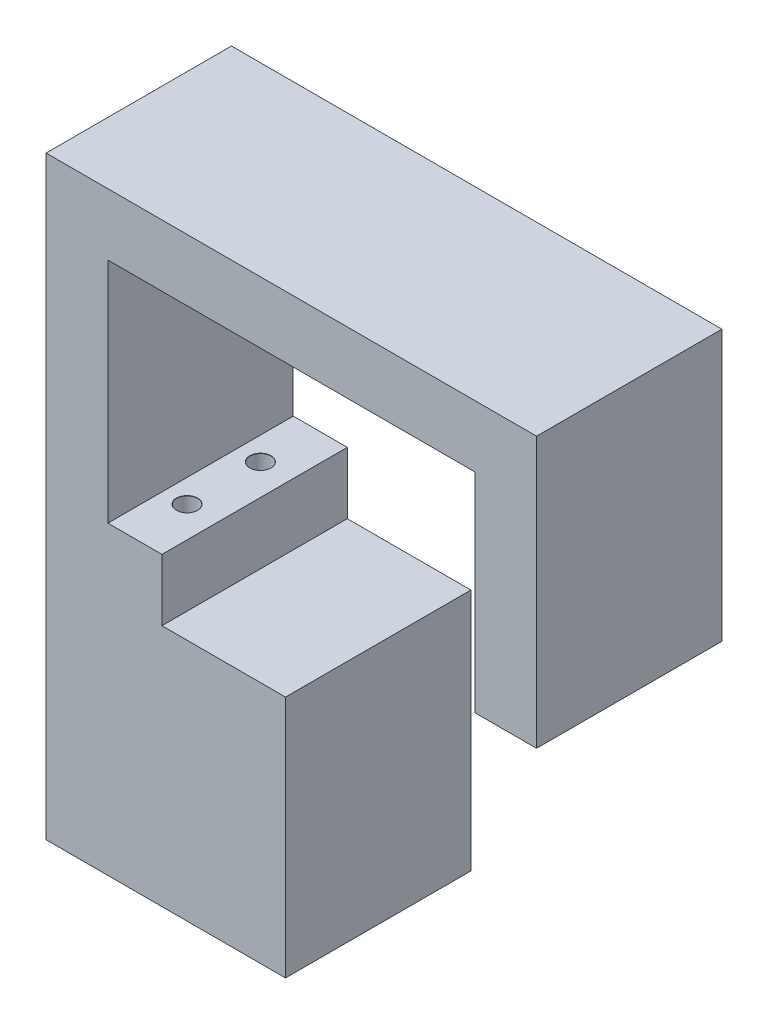
from build123d import *

# Parameters (mm, degrees)
BOSS_EXTRUDE1_DEPTH                  = 12
F_2_7_2_7_DIAMETER_HOLE1_D           = 2.7
F_2_7_2_7_DIAMETER_HOLE1_DEPTH       = 8
F_2_7_2_7_DIAMETER_HOLE1_CSINK_D     = 2.75
F_2_7_2_7_DIAMETER_HOLE1_CSINK_ANGLE = 90
F_2_7_2_7_DIAMETER_HOLE1_TIP         = 0.811161836
F_2_7_2_7_DIAMETER_HOLE2_D           = 2.7
F_2_7_2_7_DIAMETER_HOLE2_DEPTH       = 8
F_2_7_2_7_DIAMETER_HOLE2_CSINK_D     = 2.75
F_2_7_2_7_DIAMETER_HOLE2_CSINK_ANGLE = 90
F_2_7_2_7_DIAMETER_HOLE2_TIP         = 0.811161836


with BuildPart() as part:
    # Sketch1 → Boss-Extrude1 (new, symmetric)
    with BuildSketch(Plane.XY):
        Polygon((0, 0), (-23, 0), (-31, 0), (-31, 77), (-23.404895261, 77), (32.5, 77), (32.5, 42), (24.5, 42), (24.5, 69), (-23, 69), (-23, 39.5), (-16, 39.5), (-16, 31.5), (0, 31.5), align=None)
    extrude(amount=BOSS_EXTRUDE1_DEPTH, both=True)

    # Ø2.7 (2.7) Diameter Hole1
    with Locations(Plane(origin=(0, 39.5, 0), x_dir=(1, 0, 0), z_dir=(0, 1, 0))):
        with Locations((-20, 4.75), (-20, -4.75)):
            CounterSinkHole(F_2_7_2_7_DIAMETER_HOLE1_D / 2, F_2_7_2_7_DIAMETER_HOLE1_CSINK_D / 2, depth=F_2_7_2_7_DIAMETER_HOLE1_DEPTH, counter_sink_angle=F_2_7_2_7_DIAMETER_HOLE1_CSINK_ANGLE)
            with Locations((0, 0, -(F_2_7_2_7_DIAMETER_HOLE1_DEPTH + F_2_7_2_7_DIAMETER_HOLE1_TIP / 2))):  # 118° drill point
                Cone(0, F_2_7_2_7_DIAMETER_HOLE1_D / 2, F_2_7_2_7_DIAMETER_HOLE1_TIP, mode=Mode.SUBTRACT)

    # Ø2.7 (2.7) Diameter Hole2
    with Locations(Plane(origin=(0, 42, 0), x_dir=(-1, 0, 0), z_dir=(0, -1, 0))):
        with Locations((-28.5, 4.75), (-28.5, -4.75)):
            CounterSinkHole(F_2_7_2_7_DIAMETER_HOLE2_D / 2, F_2_7_2_7_DIAMETER_HOLE2_CSINK_D / 2, depth=F_2_7_2_7_DIAMETER_HOLE2_DEPTH, counter_sink_angle=F_2_7_2_7_DIAMETER_HOLE2_CSINK_ANGLE)
            with Locations((0, 0, -(F_2_7_2_7_DIAMETER_HOLE2_DEPTH + F_2_7_2_7_DIAMETER_HOLE2_TIP / 2))):  # 118° drill point
                Cone(0, F_2_7_2_7_DIAMETER_HOLE2_D / 2, F_2_7_2_7_DIAMETER_HOLE2_TIP, mode=Mode.SUBTRACT)


solid = part.part
